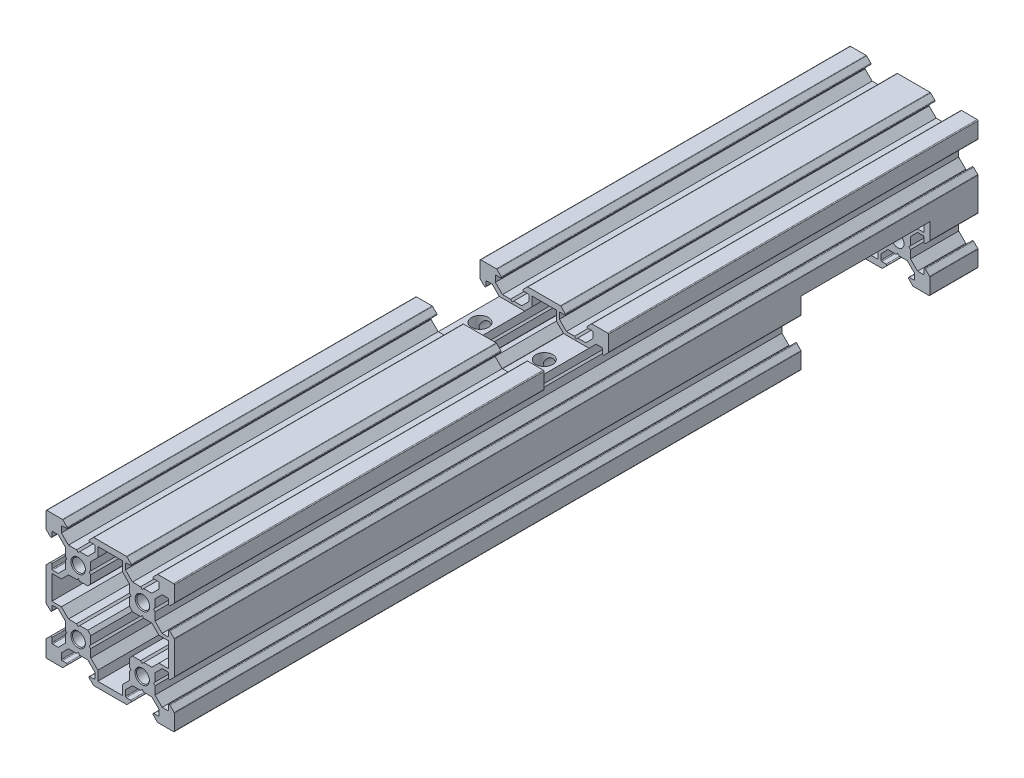
from build123d import *

# Parameters (mm, degrees)
SALIENTE_EXTRUIR1_DEPTH                              = 125
SALIENTE_EXTRUIR1_DEPTH_BACK                         = 125
CROQUIS4_R                                           = 2
CORTAR_EXTRUIR1_DEPTH                                = 254.564658979
CHAFL_N1_SIZE                                        = 0.25
CROQUIS19_W                                          = 40
CROQUIS19_H                                          = 20
CROQUIS19_W_2                                        = 20
CROQUIS19_H_2                                        = 7
CORTAR_EXTRUIR2_DEPTH                                = 135.586090399
CROQUIS20_R                                          = 1.25
CORTAR_EXTRUIR3_DEPTH                                = 135.604529727
REFRENTADO_PARA_TORNILLO_CON_CABEZA_HUEC_D           = 5.3
REFRENTADO_PARA_TORNILLO_CON_CABEZA_HUEC_CBORE_D     = 10
REFRENTADO_PARA_TORNILLO_CON_CABEZA_HUEC_CBORE_DEPTH = 5.4


with BuildPart() as part:
    # Croquis1 → Saliente-Extruir1 (new, two sides: drawn at the far end of the back side and taken through both)
    with BuildSketch(Plane.XY.offset(-SALIENTE_EXTRUIR1_DEPTH_BACK)):
        with BuildLine():
            Line((-3.509619408, 8.626776695), (-4.809619408, 9.926776695))
            ThreePointArc((-4.809619408, 9.926776695), (-4.890725245, 9.980969883), (-4.986396103, 10))
            Line((-4.986396103, 10), (-15.096446609, 10))
            ThreePointArc((-15.096446609, 10), (-15.192117467, 9.980969883), (-15.273223305, 9.926776695))
            Line((-15.273223305, 9.926776695), (-16.573223305, 8.626776695))
            ThreePointArc((-16.573223305, 8.626776695), (-16.627416493, 8.354329142), (-16.396446609, 8.2))
            Line((-16.396446609, 8.2), (-15.039949494, 8.2))
            ThreePointArc((-15.039949494, 8.2), (-14.863172798, 8.126776695), (-14.789949494, 7.95))
            Line((-14.789949494, 7.95), (-14.789949494, 6.2))
            Line((-14.789949494, 6.2), (-16.989949494, 4))
            Line((-16.989949494, 4), (-19.5, 4))
            Line((-19.5, 4), (-20, 3.5))
            Line((-20, 3.5), (-20.5, 4))
            Line((-20.5, 4), (-23.010050506, 4))
            Line((-23.010050506, 4), (-25.210050506, 6.2))
            Line((-25.210050506, 6.2), (-25.210050506, 7.95))
            ThreePointArc((-25.210050506, 7.95), (-25.136827202, 8.126776695), (-24.960050506, 8.2))
            Line((-24.960050506, 8.2), (-23.603553391, 8.2))
            ThreePointArc((-23.603553391, 8.2), (-23.372583507, 8.354329142), (-23.426776695, 8.626776695))
            Line((-23.426776695, 8.626776695), (-24.726776695, 9.926776695))
            ThreePointArc((-24.726776695, 9.926776695), (-24.807882533, 9.980969883), (-24.903553391, 10))
            Line((-24.903553391, 10), (-29.75, 10))
            ThreePointArc((-29.75, 10), (-29.926776695, 9.926776695), (-30, 9.75))
            Line((-30, 9.75), (-30, 4.903553391))
            ThreePointArc((-30, 4.903553391), (-29.980969883, 4.807882532), (-29.926776695, 4.726776695))
            Line((-29.926776695, 4.726776695), (-28.626776695, 3.426776695))
            ThreePointArc((-28.626776695, 3.426776695), (-28.354329142, 3.372583507), (-28.2, 3.603553391))
            Line((-28.2, 3.603553391), (-28.2, 4.960050506))
            ThreePointArc((-28.2, 4.960050506), (-28.126776695, 5.136827202), (-27.95, 5.210050506))
            Line((-27.95, 5.210050506), (-26.2, 5.210050506))
            Line((-26.2, 5.210050506), (-24, 3.010050506))
            Line((-24, 3.010050506), (-24, 0.5))
            Line((-24, 0.5), (-23.5, 0))
            Line((-23.5, 0), (-24, -0.5))
            Line((-24, -0.5), (-24, -3.010050506))
            Line((-24, -3.010050506), (-26.2, -5.210050506))
            Line((-26.2, -5.210050506), (-27.95, -5.210050506))
            ThreePointArc((-27.95, -5.210050506), (-28.126776695, -5.136827202), (-28.2, -4.960050506))
            Line((-28.2, -4.960050506), (-28.2, -3.603553391))
            ThreePointArc((-28.2, -3.603553391), (-28.354329142, -3.372583507), (-28.626776695, -3.426776695))
            Line((-28.626776695, -3.426776695), (-29.926776695, -4.726776695))
            ThreePointArc((-29.926776695, -4.726776695), (-29.980969883, -4.807882533), (-30, -4.903553391))
            Line((-30, -4.903553391), (-30, -6.2))
            Line((-30, -6.2), (-30, -13.717157))
            Line((-30, -13.717157), (-30, -15.013603609))
            ThreePointArc((-30, -15.013603609), (-29.980969883, -15.109274467), (-29.926776695, -15.190380305))
            Line((-29.926776695, -15.190380305), (-28.626776695, -16.490380305))
            ThreePointArc((-28.626776695, -16.490380305), (-28.354329142, -16.544573493), (-28.2, -16.313603609))
            Line((-28.2, -16.313603609), (-28.2, -14.957106494))
            ThreePointArc((-28.2, -14.957106494), (-28.126776695, -14.780329798), (-27.95, -14.707106494))
            Line((-27.95, -14.707106494), (-26.2, -14.707106494))
            Line((-26.2, -14.707106494), (-24, -16.907106494))
            Line((-24, -16.907106494), (-24, -19.417157))
            Line((-24, -19.417157), (-23.5, -19.917157))
            Line((-23.5, -19.917157), (-24, -20.417157))
            Line((-24, -20.417157), (-24, -22.927207506))
            Line((-24, -22.927207506), (-26.2, -25.127207506))
            Line((-26.2, -25.127207506), (-27.95, -25.127207506))
            ThreePointArc((-27.95, -25.127207506), (-28.126776695, -25.053984202), (-28.2, -24.877207506))
            Line((-28.2, -24.877207506), (-28.2, -23.520710391))
            ThreePointArc((-28.2, -23.520710391), (-28.354329142, -23.289740507), (-28.626776695, -23.343933695))
            Line((-28.626776695, -23.343933695), (-29.926776695, -24.643933695))
            ThreePointArc((-29.926776695, -24.643933695), (-29.980969883, -24.725039532), (-30, -24.820710391))
            Line((-30, -24.820710391), (-30, -29.667157))
            ThreePointArc((-30, -29.667157), (-29.926776695, -29.843933695), (-29.75, -29.917157))
            Line((-29.75, -29.917157), (-24.903553391, -29.917157))
            ThreePointArc((-24.903553391, -29.917157), (-24.807882533, -29.898126883), (-24.726776695, -29.843933695))
            Line((-24.726776695, -29.843933695), (-23.426776695, -28.543933695))
            ThreePointArc((-23.426776695, -28.543933695), (-23.372583507, -28.271486142), (-23.603553391, -28.117157))
            Line((-23.603553391, -28.117157), (-24.960050506, -28.117157))
            ThreePointArc((-24.960050506, -28.117157), (-25.136827202, -28.043933695), (-25.210050506, -27.867157))
            Line((-25.210050506, -27.867157), (-25.210050506, -26.117157))
            Line((-25.210050506, -26.117157), (-23.010050506, -23.917157))
            Line((-23.010050506, -23.917157), (-20.5, -23.917157))
            Line((-20.5, -23.917157), (-20, -23.417157))
            Line((-20, -23.417157), (-19.5, -23.917157))
            Line((-19.5, -23.917157), (-16.989949494, -23.917157))
            Line((-16.989949494, -23.917157), (-14.789949494, -26.117157))
            Line((-14.789949494, -26.117157), (-14.789949494, -27.867157))
            ThreePointArc((-14.789949494, -27.867157), (-14.863172798, -28.043933695), (-15.039949494, -28.117157))
            Line((-15.039949494, -28.117157), (-16.396446609, -28.117157))
            ThreePointArc((-16.396446609, -28.117157), (-16.627416493, -28.271486142), (-16.573223305, -28.543933695))
            Line((-16.573223305, -28.543933695), (-15.273223305, -29.843933695))
            ThreePointArc((-15.273223305, -29.843933695), (-15.192117467, -29.898126883), (-15.096446609, -29.917157))
            Line((-15.096446609, -29.917157), (-4.986396103, -29.917157))
            ThreePointArc((-4.986396103, -29.917157), (-4.890725245, -29.898126883), (-4.809619408, -29.843933695))
            Line((-4.809619408, -29.843933695), (-3.509619408, -28.543933695))
            ThreePointArc((-3.509619408, -28.543933695), (-3.45542622, -28.271486142), (-3.686396103, -28.117157))
            Line((-3.686396103, -28.117157), (-5.042893219, -28.117157))
            ThreePointArc((-5.042893219, -28.117157), (-5.219669914, -28.043933695), (-5.292893219, -27.867157))
            Line((-5.292893219, -27.867157), (-5.292893219, -26.117157))
            Line((-5.292893219, -26.117157), (-3.092893219, -23.917157))
            Line((-3.092893219, -23.917157), (-0.582842712, -23.917157))
            Line((-0.582842712, -23.917157), (-0.082842712, -23.417157))
            Line((-0.082842712, -23.417157), (0.417157288, -23.917157))
            Line((0.417157288, -23.917157), (2.927207794, -23.917157))
            Line((2.927207794, -23.917157), (5.127207794, -26.117157))
            Line((5.127207794, -26.117157), (5.127207794, -27.867157))
            ThreePointArc((5.127207794, -27.867157), (5.053984489, -28.043933695), (4.877207794, -28.117157))
            Line((4.877207794, -28.117157), (3.520710678, -28.117157))
            ThreePointArc((3.520710678, -28.117157), (3.289740795, -28.271486142), (3.343933983, -28.543933695))
            Line((3.343933983, -28.543933695), (4.643933983, -29.843933695))
            ThreePointArc((4.643933983, -29.843933695), (4.72503982, -29.898126883), (4.820710678, -29.917157))
            Line((4.820710678, -29.917157), (9.667157288, -29.917157))
            ThreePointArc((9.667157288, -29.917157), (9.843933983, -29.843933695), (9.917157288, -29.667157))
            Line((9.917157288, -29.667157), (9.917157288, -24.820710391))
            ThreePointArc((9.917157288, -24.820710391), (9.898127171, -24.725039533), (9.843933983, -24.643933695))
            Line((9.843933983, -24.643933695), (8.543933983, -23.343933695))
            ThreePointArc((8.543933983, -23.343933695), (8.271486429, -23.289740507), (8.117157288, -23.520710391))
            Line((8.117157288, -23.520710391), (8.117157288, -24.877207506))
            ThreePointArc((8.117157288, -24.877207506), (8.043933983, -25.053984202), (7.867157288, -25.127207506))
            Line((7.867157288, -25.127207506), (6.117157288, -25.127207506))
            Line((6.117157288, -25.127207506), (3.917157288, -22.927207506))
            Line((3.917157288, -22.927207506), (3.917157288, -20.417157))
            Line((3.917157288, -20.417157), (3.417157288, -19.917157))
            Line((3.417157288, -19.917157), (3.917157288, -19.417157))
            Line((3.917157288, -19.417157), (3.917157288, -16.907106494))
            Line((3.917157288, -16.907106494), (6.117157288, -14.707106494))
            Line((6.117157288, -14.707106494), (7.867157288, -14.707106494))
            ThreePointArc((7.867157288, -14.707106494), (8.043933983, -14.780329798), (8.117157288, -14.957106494))
            Line((8.117157288, -14.957106494), (8.117157288, -16.313603609))
            ThreePointArc((8.117157288, -16.313603609), (8.271486429, -16.544573493), (8.543933983, -16.490380305))
            Line((8.543933983, -16.490380305), (9.843933983, -15.190380305))
            ThreePointArc((9.843933983, -15.190380305), (9.898127171, -15.109274467), (9.917157288, -15.013603609))
            Line((9.917157288, -15.013603609), (9.917157288, -13.717157))
            Line((9.917157288, -13.717157), (9.917157288, -6.2))
            Line((9.917157288, -6.2), (9.917157288, -4.903553391))
            ThreePointArc((9.917157288, -4.903553391), (9.898127171, -4.807882533), (9.843933983, -4.726776695))
            Line((9.843933983, -4.726776695), (8.543933983, -3.426776695))
            ThreePointArc((8.543933983, -3.426776695), (8.271486429, -3.372583507), (8.117157288, -3.603553391))
            Line((8.117157288, -3.603553391), (8.117157288, -4.960050506))
            ThreePointArc((8.117157288, -4.960050506), (8.043933983, -5.136827202), (7.867157288, -5.210050506))
            Line((7.867157288, -5.210050506), (6.117157288, -5.210050506))
            Line((6.117157288, -5.210050506), (3.917157288, -3.010050506))
            Line((3.917157288, -3.010050506), (3.917157288, -0.5))
            Line((3.917157288, -0.5), (3.417157288, 0))
            Line((3.417157288, 0), (3.917157288, 0.5))
            Line((3.917157288, 0.5), (3.917157288, 3.010050506))
            Line((3.917157288, 3.010050506), (6.117157288, 5.210050506))
            Line((6.117157288, 5.210050506), (7.867157288, 5.210050506))
            ThreePointArc((7.867157288, 5.210050506), (8.043933983, 5.136827202), (8.117157288, 4.960050506))
            Line((8.117157288, 4.960050506), (8.117157288, 3.603553391))
            ThreePointArc((8.117157288, 3.603553391), (8.271486429, 3.372583507), (8.543933983, 3.426776695))
            Line((8.543933983, 3.426776695), (9.843933983, 4.726776695))
            ThreePointArc((9.843933983, 4.726776695), (9.898127171, 4.807882533), (9.917157288, 4.903553391))
            Line((9.917157288, 4.903553391), (9.917157288, 9.75))
            ThreePointArc((9.917157288, 9.75), (9.843933983, 9.926776695), (9.667157288, 10))
            Line((9.667157288, 10), (4.820710678, 10))
            ThreePointArc((4.820710678, 10), (4.72503982, 9.980969883), (4.643933983, 9.926776695))
            Line((4.643933983, 9.926776695), (3.343933983, 8.626776695))
            ThreePointArc((3.343933983, 8.626776695), (3.289740795, 8.354329142), (3.520710678, 8.2))
            Line((3.520710678, 8.2), (4.877207794, 8.2))
            ThreePointArc((4.877207794, 8.2), (5.053984489, 8.126776695), (5.127207794, 7.95))
            Line((5.127207794, 7.95), (5.127207794, 6.2))
            Line((5.127207794, 6.2), (2.927207794, 4))
            Line((2.927207794, 4), (0.417157288, 4))
            Line((0.417157288, 4), (-0.082842712, 3.5))
            Line((-0.082842712, 3.5), (-0.582842712, 4))
            Line((-0.582842712, 4), (-3.092893219, 4))
            Line((-3.092893219, 4), (-5.292893219, 6.2))
            Line((-5.292893219, 6.2), (-5.292893219, 7.95))
            ThreePointArc((-5.292893219, 7.95), (-5.219669914, 8.126776695), (-5.042893219, 8.2))
            Line((-5.042893219, 8.2), (-3.686396103, 8.2))
            ThreePointArc((-3.686396103, 8.2), (-3.45542622, 8.354329142), (-3.509619408, 8.626776695))
        make_face()
        Polygon((-28.2, -6.2), (-25.210050506, -6.2), (-23.010050506, -4), (-20.5, -4), (-20, -3.5), (-19.5, -4), (-16.989949494, -4), (-16.082842712, -3.010050506), (-16.082842712, -0.5), (-16.582842712, 0), (-16.082842712, 0.5), (-16.082842712, 3.010050506), (-13.882842712, 5.210050506), (-13.882842712, 8.2), (-6.2, 8.2), (-6.2, 5.210050506), (-4, 3.010050506), (-4, 0.5), (-3.5, 0), (-4, -0.5), (-4, -3.010050506), (-3.092893219, -4), (-0.582842712, -4), (-0.082842712, -3.5), (0.417157288, -4), (2.927207794, -4), (5.127207794, -6.2), (8.117157288, -6.2), (8.117157288, -13.717157), (5.127207794, -13.717157), (2.927207794, -15.917157), (0.417157288, -15.917157), (-0.082842712, -16.417157), (-0.582842712, -15.917157), (-3.092893219, -15.917157), (-4, -16.907106494), (-4, -19.417157), (-3.5, -19.917157), (-4, -20.417157), (-4, -22.927207506), (-6.2, -25.127207506), (-6.2, -28.117157), (-13.882842712, -28.117157), (-13.882842712, -25.127207506), (-16.082842712, -22.927207506), (-16.082842712, -20.417157), (-16.582842712, -19.917157), (-16.082842712, -19.417157), (-16.082842712, -16.907106494), (-16.989949494, -15.917157), (-19.5, -15.917157), (-20, -16.417157), (-20.5, -15.917157), (-23.010050506, -15.917157), (-25.210050506, -13.717157), (-28.2, -13.717157), align=None, mode=Mode.SUBTRACT)
    extrude(amount=SALIENTE_EXTRUIR1_DEPTH + SALIENTE_EXTRUIR1_DEPTH_BACK)

    # Croquis4 → Cortar-Extruir1 (cut, through all)
    with BuildSketch(Plane.XY.offset(125)):
        with Locations((-20, 0)):
            Circle(CROQUIS4_R)
        Circle(CROQUIS4_R)
        with Locations((-0.082842712, -19.917157)):
            Circle(CROQUIS4_R)
        with Locations((-20, -19.917157)):
            Circle(CROQUIS4_R)
    extrude(amount=-CORTAR_EXTRUIR1_DEPTH, mode=Mode.SUBTRACT)

    # Chaflán1
    chafl_n1_edges = [part.edges().sort_by_distance(p)[0] for p in [
        (-22, 0, -125),
        (-22, -19.917157, -125),
        (-2, 0, -125),
        (-2.082842712, -19.917157, -125),
        (-2.082842712, -19.917157, 125),
        (-2, 0, 125),
        (-22, 0, 125),
        (-22, -19.917157, 125),
    ]]
    chamfer(chafl_n1_edges, length=CHAFL_N1_SIZE)

    # Croquis19 → Cortar-Extruir2 (cut, through all)
    with BuildSketch(Plane.ZY.offset(30)):
        with Locations((-90, -19.917157)):
            Rectangle(CROQUIS19_W, CROQUIS19_H)
        with Locations((0, 6.5)):
            Rectangle(CROQUIS19_W_2, CROQUIS19_H_2)
    extrude(amount=-CORTAR_EXTRUIR2_DEPTH, mode=Mode.SUBTRACT)

    # Croquis20 → Cortar-Extruir3 (cut, through all)
    with BuildSketch(Plane(origin=(0, 10, 0), x_dir=(1, 0, 0), z_dir=(0, 1, 0))):
        with Locations((-20, 67)):
            Circle(CROQUIS20_R)
    extrude(amount=-CORTAR_EXTRUIR3_DEPTH, mode=Mode.SUBTRACT)

    # Refrentado para tornillo con cabeza hueca de M51 (through all)
    with Locations(Plane(origin=(0, -29.917157, 0), x_dir=(-1, 0, 0), z_dir=(0, -1, 0))):
        with Locations((20, 0), (0, 0)):
            CounterBoreHole(REFRENTADO_PARA_TORNILLO_CON_CABEZA_HUEC_D / 2, REFRENTADO_PARA_TORNILLO_CON_CABEZA_HUEC_CBORE_D / 2, REFRENTADO_PARA_TORNILLO_CON_CABEZA_HUEC_CBORE_DEPTH)


solid = part.part
